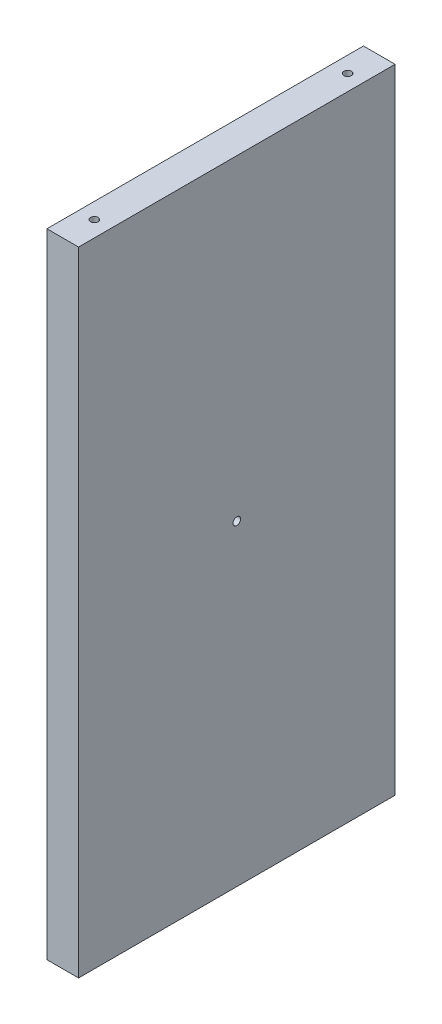
from build123d import *

# Parameters (mm, degrees)
SKETCH1_W                = 10
SKETCH1_H                = 100
BOSS_EXTRUDE1_DEPTH      = 200
M2_CLEARANCE_HOLE1_D     = 2.4
M2_CLEARANCE_HOLE1_DEPTH = 11
M2_CLEARANCE_HOLE1_TIP   = 0.721032743
M2_CLEARANCE_HOLE2_D     = 2.4
M2_CLEARANCE_HOLE2_DEPTH = 11
M2_CLEARANCE_HOLE2_TIP   = 0.721032743
M2_CLEARANCE_HOLE3_D     = 2.4


with BuildPart() as part:
    # Sketch1 → Boss-Extrude1 (new body)
    with BuildSketch(Plane(origin=(0, 0, 0), x_dir=(1, 0, 0), z_dir=(0, 1, 0))):
        Rectangle(SKETCH1_W, SKETCH1_H)
    extrude(amount=BOSS_EXTRUDE1_DEPTH)

    # M2 Clearance Hole1
    with Locations(Plane(origin=(0, 200, 0), x_dir=(1, 0, 0), z_dir=(0, 1, 0))):
        with Locations((0, 40), (0, -40)):
            Hole(M2_CLEARANCE_HOLE1_D / 2, depth=M2_CLEARANCE_HOLE1_DEPTH)
            with Locations((0, 0, -(M2_CLEARANCE_HOLE1_DEPTH + M2_CLEARANCE_HOLE1_TIP / 2))):  # 118° drill point
                Cone(0, M2_CLEARANCE_HOLE1_D / 2, M2_CLEARANCE_HOLE1_TIP, mode=Mode.SUBTRACT)

    # M2 Clearance Hole2
    with Locations(Plane(origin=(0, 0, 0), x_dir=(-1, 0, 0), z_dir=(0, -1, 0))):
        with Locations((0, 40), (0, -40)):
            Hole(M2_CLEARANCE_HOLE2_D / 2, depth=M2_CLEARANCE_HOLE2_DEPTH)
            with Locations((0, 0, -(M2_CLEARANCE_HOLE2_DEPTH + M2_CLEARANCE_HOLE2_TIP / 2))):  # 118° drill point
                Cone(0, M2_CLEARANCE_HOLE2_D / 2, M2_CLEARANCE_HOLE2_TIP, mode=Mode.SUBTRACT)

    # M2 Clearance Hole3 (through all)
    with Locations(Plane.ZY.offset(5)):
        with Locations((0, 100)):
            Hole(M2_CLEARANCE_HOLE3_D / 2)


solid = part.part
